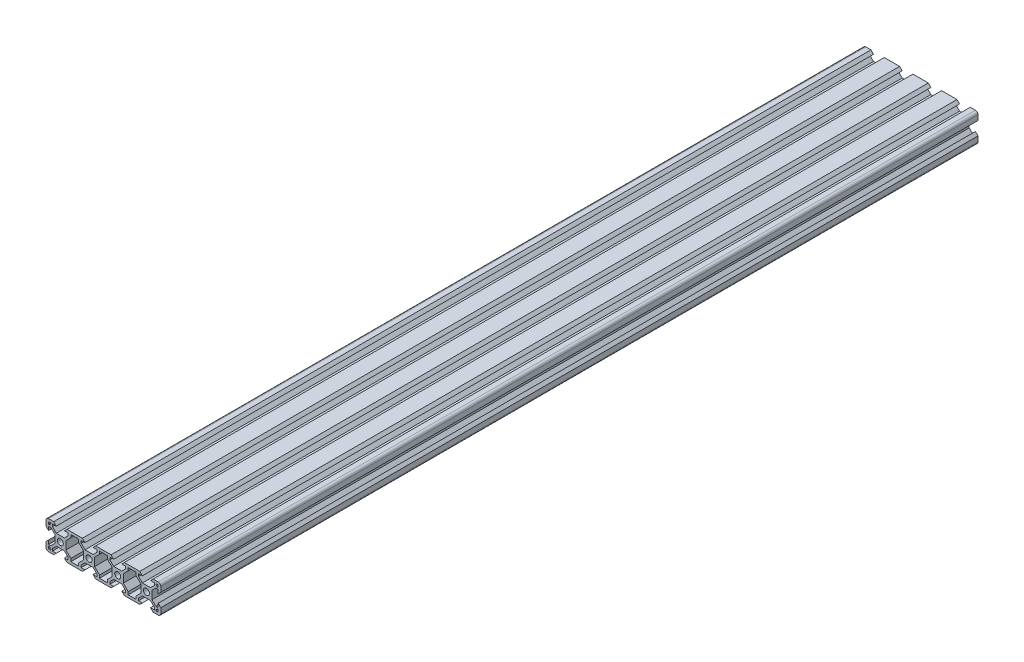
from build123d import *

# Parameters (mm, degrees)
SKETCH1_R      = 2.1
EXTRUDE1_DEPTH = 284.8


with BuildPart() as part:
    # Sketch1 → Extrude1 (new, symmetric)
    with BuildSketch(Plane.XY):
        with BuildLine():
            Line((-38.199999929, 10), (-34.639999675, 10))
            Line((-34.639999675, 10), (-32.839999603, 8.2))
            Line((-32.839999603, 8.2), (-35.499339671, 8.2))
            Line((-35.499339671, 8.2), (-35.499339671, 6.56))
            Line((-35.499339671, 6.56), (-32.839999603, 3.900660038))
            Line((-32.839999603, 3.900660038), (-27.159999603, 3.900660038))
            Line((-27.159999603, 3.900660038), (-24.500659536, 6.56))
            Line((-24.500659536, 6.56), (-24.500659536, 8.2))
            Line((-24.500659536, 8.2), (-27.159999603, 8.2))
            Line((-27.159999603, 8.2), (-25.359999532, 10))
            Line((-25.359999532, 10), (-14.640000468, 10))
            Line((-14.640000468, 10), (-12.840000397, 8.2))
            Line((-12.840000397, 8.2), (-15.499340464, 8.2))
            Line((-15.499340464, 8.2), (-15.499340464, 6.56))
            Line((-15.499340464, 6.56), (-12.840000397, 3.900660038))
            Line((-12.840000397, 3.900660038), (-7.159998809, 3.900660038))
            Line((-7.159998809, 3.900660038), (-4.500658742, 6.56))
            Line((-4.500658742, 6.56), (-4.500658742, 8.2))
            Line((-4.500658742, 8.2), (-7.159998809, 8.2))
            Line((-7.159998809, 8.2), (-5.359998738, 10))
            Line((-5.359998738, 10), (5.359998738, 10))
            Line((5.359998738, 10), (7.159998809, 8.2))
            Line((7.159998809, 8.2), (4.500658742, 8.2))
            Line((4.500658742, 8.2), (4.500658742, 6.56))
            Line((4.500658742, 6.56), (7.159998809, 3.900660038))
            Line((7.159998809, 3.900660038), (12.840000397, 3.900660038))
            Line((12.840000397, 3.900660038), (15.499340464, 6.56))
            Line((15.499340464, 6.56), (15.499340464, 8.2))
            Line((15.499340464, 8.2), (12.840000397, 8.2))
            Line((12.840000397, 8.2), (14.640000468, 10))
            Line((14.640000468, 10), (25.359999532, 10))
            Line((25.359999532, 10), (27.159999603, 8.2))
            Line((27.159999603, 8.2), (24.500659536, 8.2))
            Line((24.500659536, 8.2), (24.500659536, 6.56))
            Line((24.500659536, 6.56), (27.159999603, 3.900660038))
            Line((27.159999603, 3.900660038), (32.839999603, 3.900660038))
            Line((32.839999603, 3.900660038), (35.499339671, 6.56))
            Line((35.499339671, 6.56), (35.499339671, 8.2))
            Line((35.499339671, 8.2), (32.839999603, 8.2))
            Line((32.839999603, 8.2), (34.639999675, 10))
            Line((34.639999675, 10), (38.199999929, 10))
            ThreePointArc((38.199999929, 10), (39.47279216, 9.472792181), (39.999999929, 8.199999929))
            Line((39.999999929, 8.199999929), (39.999999787, 4.639999675))
            Line((39.999999787, 4.639999675), (38.199999716, 2.839999675))
            Line((38.199999716, 2.839999675), (38.199999821, 5.499339742))
            Line((38.199999821, 5.499339742), (36.559999821, 5.499339807))
            Line((36.559999821, 5.499339807), (33.900659754, 2.839999845))
            Line((33.900659754, 2.839999845), (33.900659641, 0))
            Line((33.900659641, 0), (33.900659754, -2.839999845))
            Line((33.900659754, -2.839999845), (36.559999821, -5.499339807))
            Line((36.559999821, -5.499339807), (38.199999821, -5.499339742))
            Line((38.199999821, -5.499339742), (38.199999716, -2.839999675))
            Line((38.199999716, -2.839999675), (39.999999787, -4.639999675))
            Line((39.999999787, -4.639999675), (39.999999929, -8.199999929))
            ThreePointArc((39.999999929, -8.199999929), (39.47279216, -9.472792181), (38.199999929, -10))
            Line((38.199999929, -10), (34.639999675, -10))
            Line((34.639999675, -10), (32.839999603, -8.2))
            Line((32.839999603, -8.2), (35.499339671, -8.2))
            Line((35.499339671, -8.2), (35.499339671, -6.56))
            Line((35.499339671, -6.56), (32.839999603, -3.900660038))
            Line((32.839999603, -3.900660038), (27.159999603, -3.900660038))
            Line((27.159999603, -3.900660038), (24.500659536, -6.56))
            Line((24.500659536, -6.56), (24.500659536, -8.2))
            Line((24.500659536, -8.2), (27.159999603, -8.2))
            Line((27.159999603, -8.2), (25.359999532, -10))
            Line((25.359999532, -10), (14.640000468, -10))
            Line((14.640000468, -10), (12.840000397, -8.2))
            Line((12.840000397, -8.2), (15.499340464, -8.2))
            Line((15.499340464, -8.2), (15.499340464, -6.56))
            Line((15.499340464, -6.56), (12.840000397, -3.900660038))
            Line((12.840000397, -3.900660038), (7.159998809, -3.900660038))
            Line((7.159998809, -3.900660038), (4.500658742, -6.56))
            Line((4.500658742, -6.56), (4.500658742, -8.2))
            Line((4.500658742, -8.2), (7.159998809, -8.2))
            Line((7.159998809, -8.2), (5.359998738, -10))
            Line((5.359998738, -10), (-5.359998738, -10))
            Line((-5.359998738, -10), (-7.159998809, -8.2))
            Line((-7.159998809, -8.2), (-4.500658742, -8.2))
            Line((-4.500658742, -8.2), (-4.500658742, -6.56))
            Line((-4.500658742, -6.56), (-7.159998809, -3.900660038))
            Line((-7.159998809, -3.900660038), (-12.840000397, -3.900660038))
            Line((-12.840000397, -3.900660038), (-15.499340464, -6.56))
            Line((-15.499340464, -6.56), (-15.499340464, -8.2))
            Line((-15.499340464, -8.2), (-12.840000397, -8.2))
            Line((-12.840000397, -8.2), (-14.640000468, -10))
            Line((-14.640000468, -10), (-25.359999532, -10))
            Line((-25.359999532, -10), (-27.159999603, -8.2))
            Line((-27.159999603, -8.2), (-24.500659536, -8.2))
            Line((-24.500659536, -8.2), (-24.500659536, -6.56))
            Line((-24.500659536, -6.56), (-27.159999603, -3.900660038))
            Line((-27.159999603, -3.900660038), (-32.839999603, -3.900660038))
            Line((-32.839999603, -3.900660038), (-35.499339671, -6.56))
            Line((-35.499339671, -6.56), (-35.499339671, -8.2))
            Line((-35.499339671, -8.2), (-32.839999603, -8.2))
            Line((-32.839999603, -8.2), (-34.639999675, -10))
            Line((-34.639999675, -10), (-38.199999929, -10))
            ThreePointArc((-38.199999929, -10), (-39.47279216, -9.472792181), (-39.999999929, -8.199999929))
            Line((-39.999999929, -8.199999929), (-39.999999787, -4.639999675))
            Line((-39.999999787, -4.639999675), (-38.199999716, -2.839999675))
            Line((-38.199999716, -2.839999675), (-38.199999821, -5.499339742))
            Line((-38.199999821, -5.499339742), (-36.559999821, -5.499339807))
            Line((-36.559999821, -5.499339807), (-33.900659754, -2.839999845))
            Line((-33.900659754, -2.839999845), (-33.900659641, 0))
            Line((-33.900659641, 0), (-33.900659754, 2.839999845))
            Line((-33.900659754, 2.839999845), (-36.559999821, 5.499339807))
            Line((-36.559999821, 5.499339807), (-38.199999821, 5.499339742))
            Line((-38.199999821, 5.499339742), (-38.199999716, 2.839999675))
            Line((-38.199999716, 2.839999675), (-39.999999787, 4.639999675))
            Line((-39.999999787, 4.639999675), (-39.999999929, 8.199999929))
            ThreePointArc((-39.999999929, 8.199999929), (-39.47279216, 9.472792181), (-38.199999929, 10))
        make_face()
        with Locations((-29.999999603, 0)):
            Circle(SKETCH1_R, mode=Mode.SUBTRACT)
        with Locations((-9.999999603, 0)):
            Circle(SKETCH1_R, mode=Mode.SUBTRACT)
        with Locations(Location((29.999999603, 0, 0), (0, 0, 180))):
            Circle(SKETCH1_R, mode=Mode.SUBTRACT)
        with Locations(Location((9.999999603, 0, 0), (0, 0, 180))):
            Circle(SKETCH1_R, mode=Mode.SUBTRACT)
        Polygon((-38.199999929, 8.2), (-38.199999864, 6.569339742), (-37.629999799, 6.569339742), (-36.569339648, 7.629999935), (-36.569339648, 8.2), align=None, mode=Mode.SUBTRACT)
        Polygon((-17.3, 6.239339079), (-17.3, 8.2), (-22.7, 8.2), (-22.7, 6.239339079), (-26.099339368, 2.839999845), (-26.099339368, -2.839999845), (-22.7, -6.239339079), (-22.7, -8.2), (-17.3, -8.2), (-17.3, -6.239339079), (-13.900660632, -2.839999845), (-13.900660632, 2.839999845), align=None, mode=Mode.SUBTRACT)
        Polygon((-6.099339678, -2.840000949), (-6.099339678, 2.840000949), (-2.700001413, 6.239339079), (-2.700001413, 8.2), (2.700001413, 8.2), (2.700001413, 6.239339079), (6.099339678, 2.840000949), (6.099339678, -2.840000949), (2.700001413, -6.239339079), (2.700001413, -8.2), (-2.700001413, -8.2), (-2.700001413, -6.239339079), align=None, mode=Mode.SUBTRACT)
        Polygon((-36.569339648, -7.629999935), (-36.569339648, -8.2), (-38.199999929, -8.2), (-38.199999864, -6.569339742), (-37.629999799, -6.569339742), align=None, mode=Mode.SUBTRACT)
        Polygon((36.569339648, 8.2), (38.199999929, 8.2), (38.199999864, 6.569339742), (37.629999799, 6.569339742), (36.569339648, 7.629999935), align=None, mode=Mode.SUBTRACT)
        Polygon((36.569339648, -8.2), (38.199999929, -8.2), (38.199999864, -6.569339742), (37.629999799, -6.569339742), (36.569339648, -7.629999935), align=None, mode=Mode.SUBTRACT)
        Polygon((13.900660632, -2.839999845), (17.3, -6.239339079), (17.3, -8.2), (22.7, -8.2), (22.7, -6.239339079), (26.099339368, -2.839999845), (26.099339368, 2.839999845), (22.7, 6.239339079), (22.7, 8.2), (17.3, 8.2), (17.3, 6.239339079), (13.900660632, 2.839999845), align=None, mode=Mode.SUBTRACT)
    extrude(amount=EXTRUDE1_DEPTH, both=True)


solid = part.part
